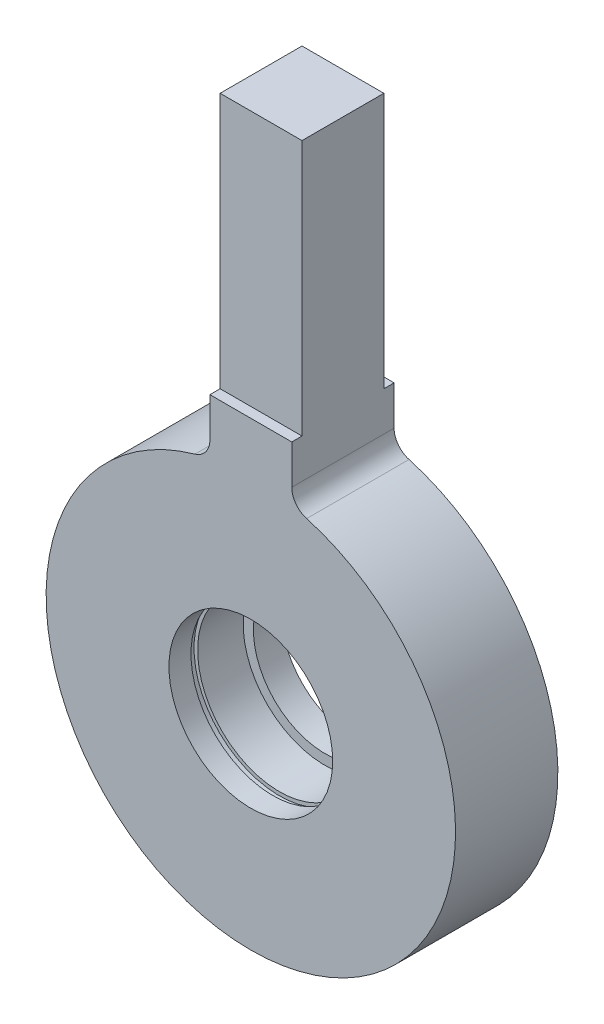
from build123d import *

# Parameters (mm, degrees)
SKETCH1_R               = 40
SKETCH1_R_2             = 14
BOSS_EXTRUDE1_DEPTH     = 10
SKETCH2_W               = 16
SKETCH2_H               = 60.808164115
BOSS_EXTRUDE2_DEPTH     = 10
FILLET1_R               = 4
SKETCH3_W               = 14.5
SKETCH3_H               = 2
SKETCH4_W               = 1.3
SKETCH4_H               = 0.7
CUT_EXTRUDE1_DEPTH      = 109.166538264
CUT_EXTRUDE1_DEPTH_BACK = 109.166538264
SKETCH5_W               = 2
SKETCH5_H               = 50


with BuildPart() as part:
    # Sketch1 → Boss-Extrude1 (new, symmetric)
    with BuildSketch(Plane.XY):
        Circle(SKETCH1_R)
        Circle(SKETCH1_R_2, mode=Mode.SUBTRACT)
    extrude(amount=BOSS_EXTRUDE1_DEPTH, both=True)

    # Sketch2 → Boss-Extrude2 (add, symmetric)
    with BuildSketch(Plane.XY):
        with Locations((0, 69.595917942)):
            Rectangle(SKETCH2_W, SKETCH2_H)
    extrude(amount=BOSS_EXTRUDE2_DEPTH, both=True)

    # Fillet1
    fillet1_edges = [part.edges().sort_by_distance(p)[0] for p in [
        (-8, 39.191835885, 0),
        (8, 39.191835885, 0),
    ]]
    fillet(fillet1_edges, radius=FILLET1_R)

    # Sketch3 → Cut-Revolve1 (revolve, cut)
    with BuildSketch(Plane(origin=(0, 0, 0), x_dir=(0, 0, -1), z_dir=(1, 0, 0)), mode=Mode.PRIVATE) as cut_revolve1_sk:
        with Locations((-2.75, 15)):
            Rectangle(SKETCH3_W, SKETCH3_H)
    revolve(cut_revolve1_sk.sketch.rotate(Axis((0, 0, 0), (0, 0, -1)), 90), axis=Axis((0, 0, 0), (0, 0, -1)), mode=Mode.SUBTRACT)

    # Sketch4 → Cut-Revolve2 (revolve, cut)
    with BuildSketch(Plane(origin=(0, 0, 0), x_dir=(0, 0, -1), z_dir=(1, 0, 0)), mode=Mode.PRIVATE) as cut_revolve2_sk:
        with Locations((-5.05, 16.35)):
            Rectangle(SKETCH4_W, SKETCH4_H)
    revolve(cut_revolve2_sk.sketch.rotate(Axis((0, 0, 0), (0, 0, -1)), 90), axis=Axis((0, 0, 0), (0, 0, -1)), mode=Mode.SUBTRACT)

    # Sketch5 → Cut-Extrude1 (cut, two sides: drawn at the far end of the back side and taken through both)
    with BuildSketch(Plane(origin=(0, 0, 0), x_dir=(0, 0, -1), z_dir=(1, 0, 0)).offset(-CUT_EXTRUDE1_DEPTH_BACK)):
        with Locations((9, 75)):
            Rectangle(SKETCH5_W, SKETCH5_H)
        with Locations((-9, 75)):
            Rectangle(SKETCH5_W, SKETCH5_H)
    extrude(amount=CUT_EXTRUDE1_DEPTH + CUT_EXTRUDE1_DEPTH_BACK, mode=Mode.SUBTRACT)


solid = part.part
